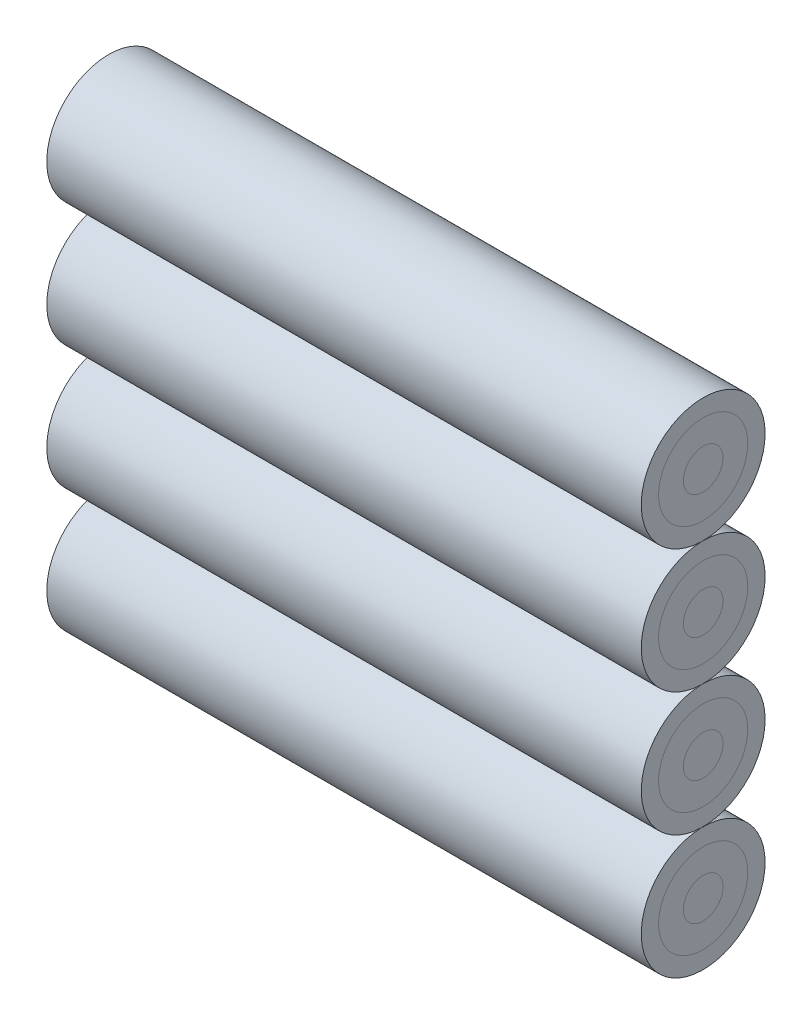
from build123d import *

# Parameters (mm, degrees)
SKETCH_1_R          = 125
EXTRUDE_1_DEPTH     = 1200
EXTRUDE_1_2_DEPTH   = 1200
EXTRUDE_1_3_DEPTH   = 1200
EXTRUDE_1_4_DEPTH   = 1200
SKETCH_2_R          = 90
CUT_EXTRUDE_1_DEPTH = 1306.995788661
SKETCH_3_R          = 90
EXTRUDE_3_DEPTH     = 1200
EXTRUDE_3_2_DEPTH   = 1200
EXTRUDE_3_3_DEPTH   = 1200
EXTRUDE_3_4_DEPTH   = 1200
SKETCH_4_R          = 40
CUT_EXTRUDE_2_DEPTH = 1306.995788661
SKETCH_5_R          = 40
EXTRUDE_7_DEPTH     = 1200
EXTRUDE_7_2_DEPTH   = 1200
EXTRUDE_7_3_DEPTH   = 1200
EXTRUDE_7_4_DEPTH   = 1200


with BuildPart() as part:
    # 草图1 → 凸台-拉伸1 (new body)
    with BuildSketch(Plane(origin=(0, 0, 0), x_dir=(0, 0, -1), z_dir=(1, 0, 0))):
        with Locations((0, -375)):
            Circle(SKETCH_1_R)
    extrude(amount=EXTRUDE_1_DEPTH)


with BuildPart() as body_2:
    # 草图1 → Extrude 1 2 (new body)
    with BuildSketch(Plane(origin=(0, 0, 0), x_dir=(0, 0, -1), z_dir=(1, 0, 0))):
        with Locations((0, 375)):
            Circle(SKETCH_1_R)
    extrude(amount=EXTRUDE_1_2_DEPTH)


with BuildPart() as body_3:
    # 草图1 → Extrude 1 3 (new body)
    with BuildSketch(Plane(origin=(0, 0, 0), x_dir=(0, 0, -1), z_dir=(1, 0, 0))):
        with Locations((0, 125)):
            Circle(SKETCH_1_R)
    extrude(amount=EXTRUDE_1_3_DEPTH)


with BuildPart() as body_4:
    # 草图1 → Extrude 1 4 (new body)
    with BuildSketch(Plane(origin=(0, 0, 0), x_dir=(0, 0, -1), z_dir=(1, 0, 0))):
        with Locations((0, -125)):
            Circle(SKETCH_1_R)
    extrude(amount=EXTRUDE_1_4_DEPTH)


with BuildPart() as cut_extrude_1_tool:
    # 草图2 → 切除-拉伸1 (new, through all)
    with BuildSketch(Plane(origin=(1200, 0, 0), x_dir=(0, 0, -1), z_dir=(1, 0, 0))):
        with Locations((0, 375)):
            Circle(SKETCH_2_R)
        with Locations((0, 125)):
            Circle(SKETCH_2_R)
        with Locations((0, -125)):
            Circle(SKETCH_2_R)
        with Locations((0, -375)):
            Circle(SKETCH_2_R)
    extrude(amount=-CUT_EXTRUDE_1_DEPTH)


with BuildPart() as part_1:
    add(part.part)

    # 切除-拉伸1: cut by cut_extrude_1_tool
    add(cut_extrude_1_tool.part, mode=Mode.SUBTRACT)


with BuildPart() as body_2_1:
    add(body_2.part)

    # 切除-拉伸1: cut by cut_extrude_1_tool
    add(cut_extrude_1_tool.part, mode=Mode.SUBTRACT)


with BuildPart() as body_3_1:
    add(body_3.part)

    # 切除-拉伸1: cut by cut_extrude_1_tool
    add(cut_extrude_1_tool.part, mode=Mode.SUBTRACT)


with BuildPart() as body_4_1:
    add(body_4.part)

    # 切除-拉伸1: cut by cut_extrude_1_tool
    add(cut_extrude_1_tool.part, mode=Mode.SUBTRACT)


with BuildPart() as body_5:
    # 草图3 → 凸台-拉伸3 (new body)
    with BuildSketch(Plane(origin=(0, 0, 0), x_dir=(0, 0, -1), z_dir=(1, 0, 0))):
        with Locations((0, 375)):
            Circle(SKETCH_3_R)
    extrude(amount=EXTRUDE_3_DEPTH)


with BuildPart() as body_6:
    # 草图3 → Extrude 3 2 (new body)
    with BuildSketch(Plane(origin=(0, 0, 0), x_dir=(0, 0, -1), z_dir=(1, 0, 0))):
        with Locations((0, 125)):
            Circle(SKETCH_3_R)
    extrude(amount=EXTRUDE_3_2_DEPTH)


with BuildPart() as body_7:
    # 草图3 → Extrude 3 3 (new body)
    with BuildSketch(Plane(origin=(0, 0, 0), x_dir=(0, 0, -1), z_dir=(1, 0, 0))):
        with Locations((0, -125)):
            Circle(SKETCH_3_R)
    extrude(amount=EXTRUDE_3_3_DEPTH)


with BuildPart() as body_8:
    # 草图3 → Extrude 3 4 (new body)
    with BuildSketch(Plane(origin=(0, 0, 0), x_dir=(0, 0, -1), z_dir=(1, 0, 0))):
        with Locations((0, -375)):
            Circle(SKETCH_3_R)
    extrude(amount=EXTRUDE_3_4_DEPTH)


with BuildPart() as cut_extrude_2_tool:
    # 草图4 → 切除-拉伸2 (new, through all)
    with BuildSketch(Plane(origin=(1200, 0, 0), x_dir=(0, 0, -1), z_dir=(1, 0, 0))):
        with Locations((0, 375)):
            Circle(SKETCH_4_R)
        with Locations((0, 125)):
            Circle(SKETCH_4_R)
        with Locations((0, -125)):
            Circle(SKETCH_4_R)
        with Locations((0, -375)):
            Circle(SKETCH_4_R)
    extrude(amount=-CUT_EXTRUDE_2_DEPTH)


with BuildPart() as body_5_1:
    add(body_5.part)

    # 切除-拉伸2: cut by cut_extrude_2_tool
    add(cut_extrude_2_tool.part, mode=Mode.SUBTRACT)


with BuildPart() as body_6_1:
    add(body_6.part)

    # 切除-拉伸2: cut by cut_extrude_2_tool
    add(cut_extrude_2_tool.part, mode=Mode.SUBTRACT)


with BuildPart() as body_7_1:
    add(body_7.part)

    # 切除-拉伸2: cut by cut_extrude_2_tool
    add(cut_extrude_2_tool.part, mode=Mode.SUBTRACT)


with BuildPart() as body_8_1:
    add(body_8.part)

    # 切除-拉伸2: cut by cut_extrude_2_tool
    add(cut_extrude_2_tool.part, mode=Mode.SUBTRACT)


with BuildPart() as body_9:
    # 草图5 → 凸台-拉伸7 (new body)
    with BuildSketch(Plane(origin=(0, 0, 0), x_dir=(0, 0, -1), z_dir=(1, 0, 0))):
        with Locations((0, 375)):
            Circle(SKETCH_5_R)
    extrude(amount=EXTRUDE_7_DEPTH)


with BuildPart() as body_10:
    # 草图5 → Extrude 7 2 (new body)
    with BuildSketch(Plane(origin=(0, 0, 0), x_dir=(0, 0, -1), z_dir=(1, 0, 0))):
        with Locations((0, 125)):
            Circle(SKETCH_5_R)
    extrude(amount=EXTRUDE_7_2_DEPTH)


with BuildPart() as body_11:
    # 草图5 → Extrude 7 3 (new body)
    with BuildSketch(Plane(origin=(0, 0, 0), x_dir=(0, 0, -1), z_dir=(1, 0, 0))):
        with Locations((0, -125)):
            Circle(SKETCH_5_R)
    extrude(amount=EXTRUDE_7_3_DEPTH)


with BuildPart() as body_12:
    # 草图5 → Extrude 7 4 (new body)
    with BuildSketch(Plane(origin=(0, 0, 0), x_dir=(0, 0, -1), z_dir=(1, 0, 0))):
        with Locations((0, -375)):
            Circle(SKETCH_5_R)
    extrude(amount=EXTRUDE_7_4_DEPTH)


solid = Compound([part_1.part, body_2_1.part, body_3_1.part, body_4_1.part, body_5_1.part, body_6_1.part, body_7_1.part, body_8_1.part, body_9.part, body_10.part, body_11.part, body_12.part])
